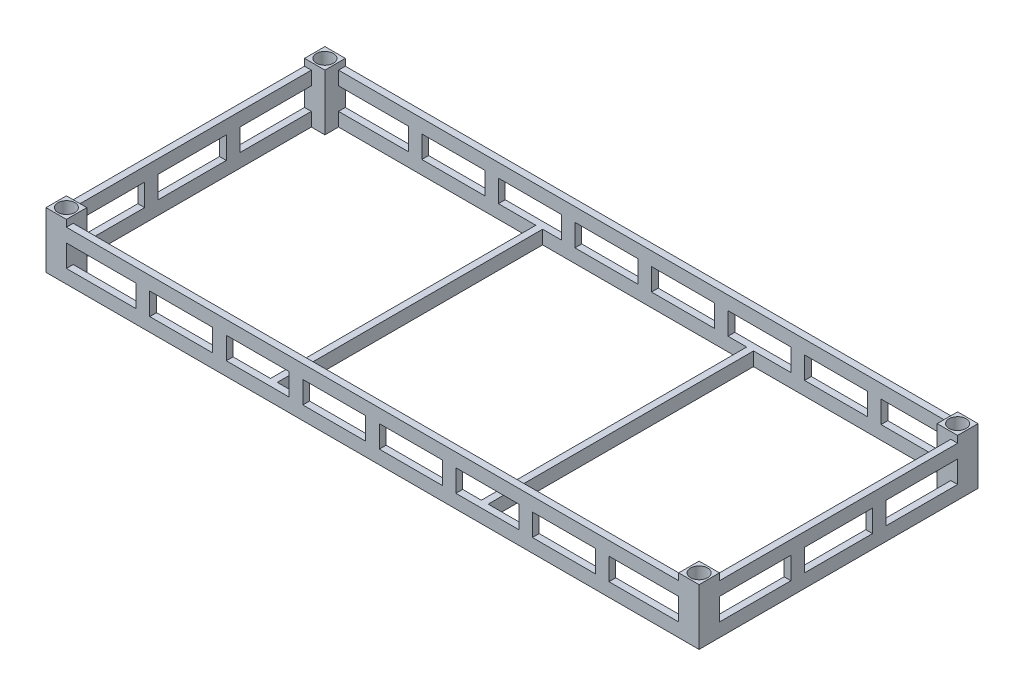
from build123d import *

# Parameters (mm, degrees)
SKETCH1_W               = 900
SKETCH1_H               = 20
SKETCH1_W_2             = 20
SKETCH1_H_2             = 350
SKETCH1_H_3             = 700
BOSS_EXTRUDE1_DEPTH     = 165
CUT_EXTRUDE1_DEPTH      = 2095.283887156
CUT_EXTRUDE1_DEPTH_BACK = 2095.283887156
SKETCH2_W               = 205
SKETCH2_H               = 65
SKETCH2_W_2             = 185
SKETCH2_W_3             = 1800
SKETCH2_H_2             = 20
CUT_EXTRUDE2_DEPTH      = 2095.283887156
CUT_EXTRUDE2_DEPTH_BACK = 2095.283887156
SKETCH3_W               = 200
SKETCH3_H               = 65
SKETCH3_W_2             = 210
SKETCH5_W               = 20
SKETCH5_H               = 780
BOSS_EXTRUDE3_DEPTH     = 40
SCALE2_SCALE            = 0.1


with BuildPart() as part:
    # Sketch1 → Boss-Extrude1 (new body)
    with BuildSketch(Plane(origin=(0, 0, 0), x_dir=(1, 0, 0), z_dir=(0, 1, 0))):
        Polygon((5, 815), (0, 815), (0, 765), (5, 765), (5, 790), align=None)
        with BuildLine():
            Line((5, 790), (5, 765))
            Line((5, 765), (12.32233047, 772.32233047))
            ThreePointArc((12.32233047, 772.32233047), (6.903011687, 780.432914191), (5, 790))
        make_face()
        with BuildLine():
            Line((12.32233047, 772.32233047), (5, 765))
            Line((5, 765), (30, 765))
            ThreePointArc((30, 765), (20.432914191, 766.903011687), (12.32233047, 772.32233047))
        make_face()
        Polygon((5, 765), (0, 765), (0, 760), align=None)
        Polygon((5, 765), (0, 760), (20, 760), (60, 760), (60, 765), (55, 765), (30, 765), align=None)
        with BuildLine():
            Line((55, 765), (55, 790))
            ThreePointArc((55, 790), (47.67766953, 772.32233047), (30, 765))
            Line((30, 765), (55, 765))
        make_face()
        Polygon((60, 800), (60, 820), (55, 815), (55, 790), (55, 765), (60, 765), align=None)
        with BuildLine():
            Line((30, 815), (5, 815))
            Line((5, 815), (5, 790))
            ThreePointArc((5, 790), (12.32233047, 807.67766953), (30, 815))
        make_face()
        Polygon((55, 820), (0, 820), (0, 815), (5, 815), (30, 815), (55, 815), align=None)
        with BuildLine():
            Line((47.67766953, 807.67766953), (55, 815))
            Line((55, 815), (30, 815))
            ThreePointArc((30, 815), (39.567085809, 813.096988313), (47.67766953, 807.67766953))
        make_face()
        with BuildLine():
            Line((55, 790), (55, 815))
            Line((55, 815), (47.67766953, 807.67766953))
            ThreePointArc((47.67766953, 807.67766953), (53.096988313, 799.567085809), (55, 790))
        make_face()
        Polygon((60, 820), (55, 820), (55, 815), align=None)
        with Locations((510, 810)):
            Rectangle(SKETCH1_W, SKETCH1_H)
        with Locations((10, 585)):
            Rectangle(SKETCH1_W_2, SKETCH1_H_2)
        with Locations((10, 235)):
            Rectangle(SKETCH1_W_2, SKETCH1_H_2)
        Polygon((5, 55), (0, 60), (0, 55), align=None)
        Polygon((5, 55), (0, 55), (0, 5), (5, 5), (5, 30), align=None)
        Polygon((20, 60), (0, 60), (5, 55), (30, 55), (55, 55), (60, 55), (60, 60), align=None)
        with BuildLine():
            Line((30, 55), (5, 55))
            Line((5, 55), (12.32233047, 47.67766953))
            ThreePointArc((12.32233047, 47.67766953), (20.432914191, 53.096988313), (30, 55))
        make_face()
        with BuildLine():
            Line((12.32233047, 47.67766953), (5, 55))
            Line((5, 55), (5, 30))
            ThreePointArc((5, 30), (6.903011687, 39.567085809), (12.32233047, 47.67766953))
        make_face()
        with BuildLine():
            Line((55, 55), (30, 55))
            ThreePointArc((30, 55), (47.67766953, 47.67766953), (55, 30))
            Line((55, 30), (55, 55))
        make_face()
        Polygon((60, 0), (60, 20), (60, 55), (55, 55), (55, 30), (55, 5), align=None)
        with BuildLine():
            Line((55, 5), (47.67766953, 12.32233047))
            ThreePointArc((47.67766953, 12.32233047), (39.567085809, 6.903011687), (30, 5))
            Line((30, 5), (55, 5))
        make_face()
        with BuildLine():
            ThreePointArc((55, 30), (53.096988313, 20.432914191), (47.67766953, 12.32233047))
            Line((47.67766953, 12.32233047), (55, 5))
            Line((55, 5), (55, 30))
        make_face()
        Polygon((5, 5), (0, 5), (0, 0), (55, 0), (55, 5), (30, 5), align=None)
        Polygon((55, 0), (60, 0), (55, 5), align=None)
        with BuildLine():
            ThreePointArc((30, 5), (12.32233047, 12.32233047), (5, 30))
            Line((5, 30), (5, 5))
            Line((5, 5), (30, 5))
        make_face()
        with Locations((510, 10)):
            Rectangle(SKETCH1_W, SKETCH1_H)
        with Locations((1410, 10)):
            Rectangle(SKETCH1_W, SKETCH1_H)
        Polygon((1860, 55), (1860, 20), (1860, 0), (1865, 5), (1865, 30), (1865, 55), align=None)
        with BuildLine():
            Line((1865, 30), (1865, 5))
            Line((1865, 5), (1872.32233047, 12.32233047))
            ThreePointArc((1872.32233047, 12.32233047), (1866.903011687, 20.432914191), (1865, 30))
        make_face()
        with BuildLine():
            Line((1872.32233047, 12.32233047), (1865, 5))
            Line((1865, 5), (1890, 5))
            ThreePointArc((1890, 5), (1880.432914191, 6.903011687), (1872.32233047, 12.32233047))
        make_face()
        Polygon((1865, 5), (1860, 0), (1865, 0), align=None)
        Polygon((1865, 5), (1865, 0), (1920, 0), (1920, 5), (1915, 5), (1890, 5), align=None)
        with BuildLine():
            ThreePointArc((1915, 30), (1907.67766953, 12.32233047), (1890, 5))
            Line((1890, 5), (1915, 5))
            Line((1915, 5), (1915, 30))
        make_face()
        Polygon((1920, 5), (1920, 55), (1915, 55), (1915, 30), (1915, 5), align=None)
        Polygon((1860, 60), (1860, 55), (1865, 55), (1890, 55), (1915, 55), (1920, 60), (1900, 60), align=None)
        with BuildLine():
            Line((1890, 55), (1865, 55))
            Line((1865, 55), (1865, 30))
            ThreePointArc((1865, 30), (1872.32233047, 47.67766953), (1890, 55))
        make_face()
        with BuildLine():
            Line((1915, 55), (1890, 55))
            ThreePointArc((1890, 55), (1899.567085809, 53.096988313), (1907.67766953, 47.67766953))
            Line((1907.67766953, 47.67766953), (1915, 55))
        make_face()
        Polygon((1920, 55), (1920, 60), (1915, 55), align=None)
        with BuildLine():
            Line((1915, 30), (1915, 55))
            Line((1915, 55), (1907.67766953, 47.67766953))
            ThreePointArc((1907.67766953, 47.67766953), (1913.096988313, 39.567085809), (1915, 30))
        make_face()
        with Locations((1910, 410)):
            Rectangle(SKETCH1_W_2, SKETCH1_H_3)
        Polygon((1865, 765), (1860, 765), (1860, 760), (1900, 760), (1920, 760), (1915, 765), (1890, 765), align=None)
        Polygon((1920, 760), (1920, 765), (1915, 765), align=None)
        with BuildLine():
            ThreePointArc((1915, 790), (1913.096988313, 780.432914191), (1907.67766953, 772.32233047))
            Line((1907.67766953, 772.32233047), (1915, 765))
            Line((1915, 765), (1915, 790))
        make_face()
        with BuildLine():
            Line((1915, 765), (1907.67766953, 772.32233047))
            ThreePointArc((1907.67766953, 772.32233047), (1899.567085809, 766.903011687), (1890, 765))
            Line((1890, 765), (1915, 765))
        make_face()
        Polygon((1920, 765), (1920, 815), (1915, 815), (1915, 790), (1915, 765), align=None)
        Polygon((1920, 820), (1865, 820), (1865, 815), (1890, 815), (1915, 815), (1920, 815), align=None)
        with BuildLine():
            Line((1915, 815), (1890, 815))
            ThreePointArc((1890, 815), (1907.67766953, 807.67766953), (1915, 790))
            Line((1915, 790), (1915, 815))
        make_face()
        Polygon((1865, 820), (1860, 820), (1865, 815), align=None)
        Polygon((1865, 815), (1860, 820), (1860, 800), (1860, 765), (1865, 765), (1865, 790), align=None)
        with BuildLine():
            Line((1872.32233047, 807.67766953), (1865, 815))
            Line((1865, 815), (1865, 790))
            ThreePointArc((1865, 790), (1866.903011687, 799.567085809), (1872.32233047, 807.67766953))
        make_face()
        with BuildLine():
            Line((1890, 815), (1865, 815))
            Line((1865, 815), (1872.32233047, 807.67766953))
            ThreePointArc((1872.32233047, 807.67766953), (1880.432914191, 813.096988313), (1890, 815))
        make_face()
        with BuildLine():
            ThreePointArc((1890, 765), (1872.32233047, 772.32233047), (1865, 790))
            Line((1865, 790), (1865, 765))
            Line((1865, 765), (1890, 765))
        make_face()
        with Locations((1410, 810)):
            Rectangle(SKETCH1_W, SKETCH1_H)
    extrude(amount=BOSS_EXTRUDE1_DEPTH)

    # Sketch2 → Cut-Extrude1 (cut, two sides: drawn at the far end of the back side and taken through both)
    with BuildSketch(Plane.XY.offset(-CUT_EXTRUDE1_DEPTH_BACK)):
        with Locations((162.5, 72.5)):
            Rectangle(SKETCH2_W, SKETCH2_H)
        with Locations((397.5, 72.5)):
            Rectangle(SKETCH2_W_2, SKETCH2_H)
        with Locations((622.5, 72.5)):
            Rectangle(SKETCH2_W_2, SKETCH2_H)
        with Locations((847.5, 72.5)):
            Rectangle(SKETCH2_W_2, SKETCH2_H)
        with Locations((1072.5, 72.5)):
            Rectangle(SKETCH2_W_2, SKETCH2_H)
        with Locations((1297.5, 72.5)):
            Rectangle(SKETCH2_W_2, SKETCH2_H)
        with Locations((1522.5, 72.5)):
            Rectangle(SKETCH2_W_2, SKETCH2_H)
        with Locations((1757.5, 72.5)):
            Rectangle(SKETCH2_W, SKETCH2_H)
        with Locations((960, 155)):
            Rectangle(SKETCH2_W_3, SKETCH2_H_2)
    extrude(amount=CUT_EXTRUDE1_DEPTH + CUT_EXTRUDE1_DEPTH_BACK, mode=Mode.SUBTRACT)

    # Sketch3 → Cut-Extrude2 (cut, two sides: drawn at the far end of the back side and taken through both)
    with BuildSketch(Plane(origin=(1920, 0, 0), x_dir=(0, 0, -1), z_dir=(1, 0, 0)).offset(-CUT_EXTRUDE2_DEPTH_BACK)):
        Polygon((410, 145), (410, 165), (60, 165), (60, 145), (270, 145), (310, 145), align=None)
        Polygon((760, 145), (760, 165), (410, 165), (410, 145), (510, 145), (550, 145), align=None)
        with Locations((410, 72.5)):
            Rectangle(SKETCH3_W, SKETCH3_H)
        with Locations((655, 72.5)):
            Rectangle(SKETCH3_W_2, SKETCH3_H)
        with Locations((165, 72.5)):
            Rectangle(SKETCH3_W_2, SKETCH3_H)
    extrude(amount=CUT_EXTRUDE2_DEPTH + CUT_EXTRUDE2_DEPTH_BACK, mode=Mode.SUBTRACT)

    # Sketch5 → Boss-Extrude3 (add)
    with BuildSketch(Plane.XZ):
        with Locations((650, -410)):
            Rectangle(SKETCH5_W, SKETCH5_H)
        with Locations((1270, -410)):
            Rectangle(SKETCH5_W, SKETCH5_H)
    extrude(amount=-BOSS_EXTRUDE3_DEPTH)


with BuildPart() as part_1:
    # Scale2: scaled about (960, 67.642168167, -410)
    add(part.part.scale(SCALE2_SCALE).moved(Location((864, 60.87795135, -369))))


solid = part_1.part
